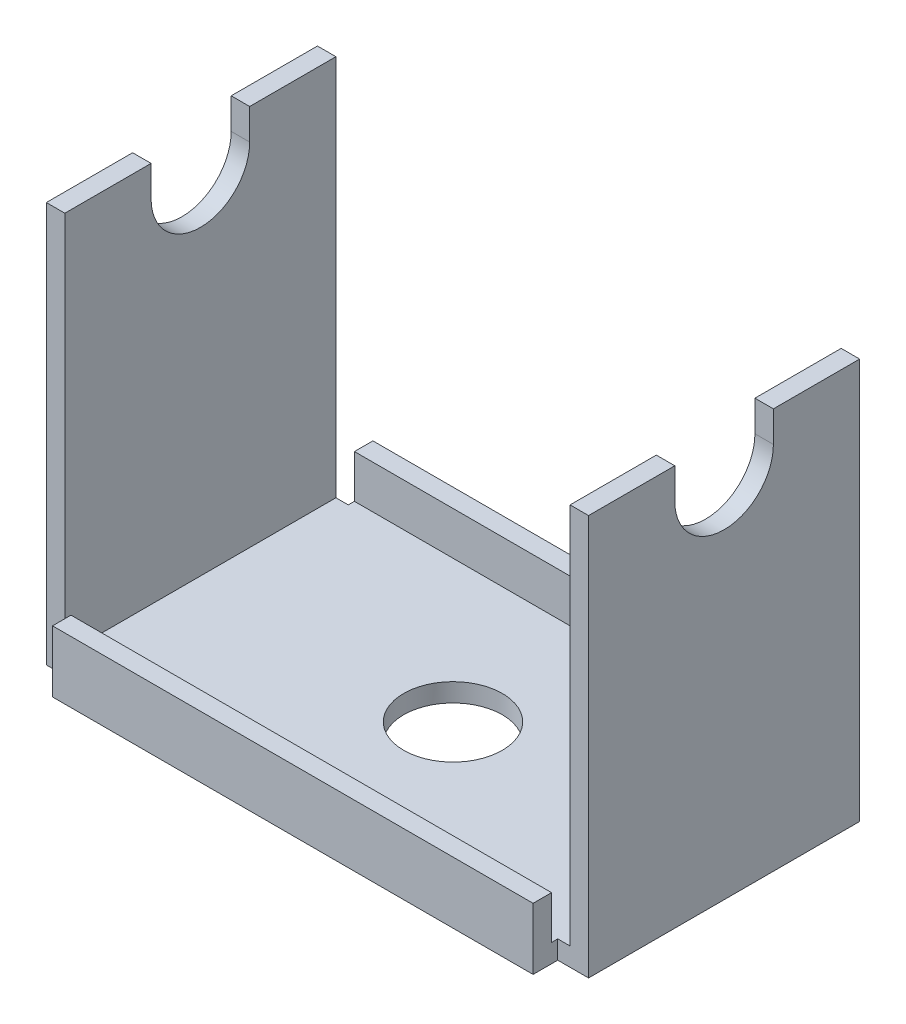
from build123d import *

# Parameters (mm, degrees)
BOSS_EXTRUDE1_DEPTH = 11
BOSS_EXTRUDE2_DEPTH = 19.5
SKETCH3_R           = 4
CUT_EXTRUDE1_DEPTH  = 41.174618853
CUT_EXTRUDE2_DEPTH  = 57.224994442


with BuildPart() as part:
    # Sketch1 → Boss-Extrude1 (new, symmetric)
    with BuildSketch(Plane.XY):
        Polygon((-22, 32.5), (-22, 0), (22, 0), (22, 32.5), (20.5, 32.5), (20.5, 1.5), (-20.5, 1.5), (-20.5, 32.5), align=None)
    extrude(amount=BOSS_EXTRUDE1_DEPTH, both=True)

    # Sketch2 → Boss-Extrude2 (add, symmetric)
    with BuildSketch(Plane(origin=(0, 0, 0), x_dir=(0, 0, -1), z_dir=(1, 0, 0))):
        Polygon((-11, 0), (-13, 0), (-13, 5), (-11.5, 5), (-11.5, 1.5), (-11, 1.5), align=None)
    boss_extrude2 = extrude(amount=BOSS_EXTRUDE2_DEPTH, both=True)

    # Mirror1: Boss-Extrude2 across plane
    add(boss_extrude2.mirror(Plane.XY))

    # Sketch3 → Cut-Extrude1 (cut, through all)
    with BuildSketch(Plane(origin=(0, 1.5, 0), x_dir=(-1, 0, 0), z_dir=(0, 1, 0))):
        with Locations(Location((0, 0, 0), (0, 0, 90))):
            Circle(SKETCH3_R)
    extrude(amount=-CUT_EXTRUDE1_DEPTH, mode=Mode.SUBTRACT)

    # Sketch4 → Cut-Extrude2 (cut, through all)
    with BuildSketch(Plane(origin=(22, 0, 0), x_dir=(0, 0, -1), z_dir=(1, 0, 0))):
        with BuildLine():
            Line((-4, 30), (-4, 32.5))
            Line((-4, 32.5), (4, 32.5))
            Line((4, 32.5), (4, 30))
            ThreePointArc((4, 30), (0, 26), (-4, 30))
        make_face()
    extrude(amount=-CUT_EXTRUDE2_DEPTH, mode=Mode.SUBTRACT)


solid = part.part
